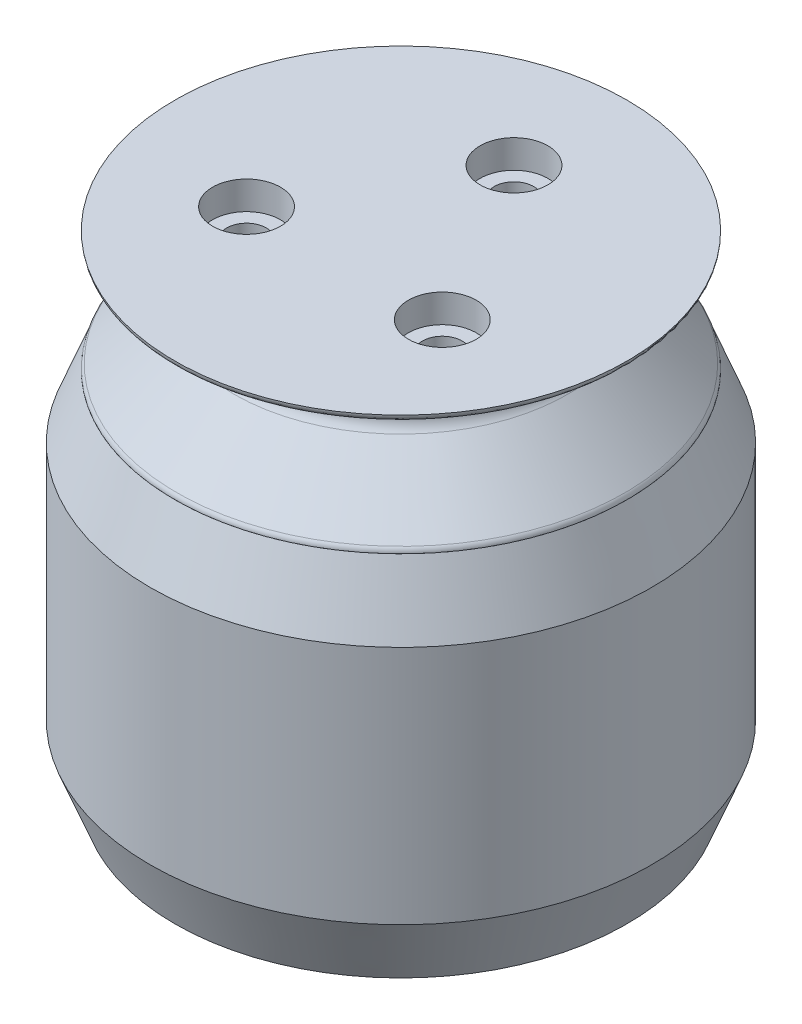
from build123d import *

# Parameters (mm, degrees)
SKETCH3_R               = 1.4
CUT_EXTRUDE1_DEPTH      = 10
SKETCH3_2_R             = 2.4
SKETCH3_2_R_2           = 1.4
CUT_EXTRUDE_THIN1_DEPTH = 2


with BuildPart() as part:
    # Sketch1 → Revolve1 (revolve)
    with BuildSketch(Plane(origin=(0, 0, 0), x_dir=(0, 0, -1), z_dir=(1, 0, 0))):
        Polygon((0, 0), (16, 0), (17.75, 4.5), (17.75, 21.5), (16, 26), (5.5, 26), (5.5, 30), (0, 30), align=None)
    revolve(axis=Axis((0, 30, 0), (0, -1, 0)))


with BuildPart() as body_2:
    # Sketch2 → Revolve2 (revolve)
    with BuildSketch(Plane(origin=(0, 0, 0), x_dir=(0, 0, -1), z_dir=(1, 0, 0))):
        with BuildLine():
            Line((-16, 26), (-6, 26))
            Line((-6, 26), (-6, 30.5))
            Line((-6, 30.5), (0, 30.5))
            Line((0, 30.5), (0, 34.5))
            Line((0, 34.5), (-16, 34.5))
            ThreePointArc((-16, 34.5), (-15.921695723, 34.231350196), (-15.711309131, 34.046846106))
            Line((-15.711309131, 34.046846106), (-12.179533539, 32.399952101))
            ThreePointArc((-12.179533539, 32.399952101), (-11.476796675, 31.48412759), (-11.82392289, 30.383183891))
            Line((-11.82392289, 30.383183891), (-15.853553391, 26.353553391))
            ThreePointArc((-15.853553391, 26.353553391), (-15.961939766, 26.191341716), (-16, 26))
        make_face()
    revolve(axis=Axis((0, 30.5, 0), (0, 1, 0)))

    # Sketch3 → Cut-Extrude1 (cut)
    with BuildSketch(Plane(origin=(0, 34.5, 0), x_dir=(1, 0, 0), z_dir=(0, 1, 0))):
        with Locations((0, 8)):
            Circle(SKETCH3_R)
        with Locations((6.92820323, -4)):
            Circle(SKETCH3_R)
        with Locations((-6.92820323, -4)):
            Circle(SKETCH3_R)
    extrude(amount=-CUT_EXTRUDE1_DEPTH, mode=Mode.SUBTRACT)

    # Sketch3<2> → Cut-Extrude-Thin1 (cut)
    # profile 1 of 3: a face of its own
    with BuildSketch(Plane(origin=(0, 34.5, 0), x_dir=(1, 0, 0), z_dir=(0, 1, 0))):
        with Locations((0, 8)):
            Circle(SKETCH3_2_R)
        with Locations((0, 8)):
            Circle(SKETCH3_2_R_2, mode=Mode.SUBTRACT)
    # profile 2 of 3: a face of its own
    with BuildSketch(Plane(origin=(0, 34.5, 0), x_dir=(1, 0, 0), z_dir=(0, 1, 0))):
        with Locations((6.92820323, -4)):
            Circle(SKETCH3_2_R)
        with Locations((6.92820323, -4)):
            Circle(SKETCH3_2_R_2, mode=Mode.SUBTRACT)
    # profile 3 of 3: a face of its own
    with BuildSketch(Plane(origin=(0, 34.5, 0), x_dir=(1, 0, 0), z_dir=(0, 1, 0))):
        with Locations((-6.92820323, -4)):
            Circle(SKETCH3_2_R)
        with Locations((-6.92820323, -4)):
            Circle(SKETCH3_2_R_2, mode=Mode.SUBTRACT)
    extrude(amount=-CUT_EXTRUDE_THIN1_DEPTH, mode=Mode.SUBTRACT)


solid = Compound([part.part, body_2.part])
